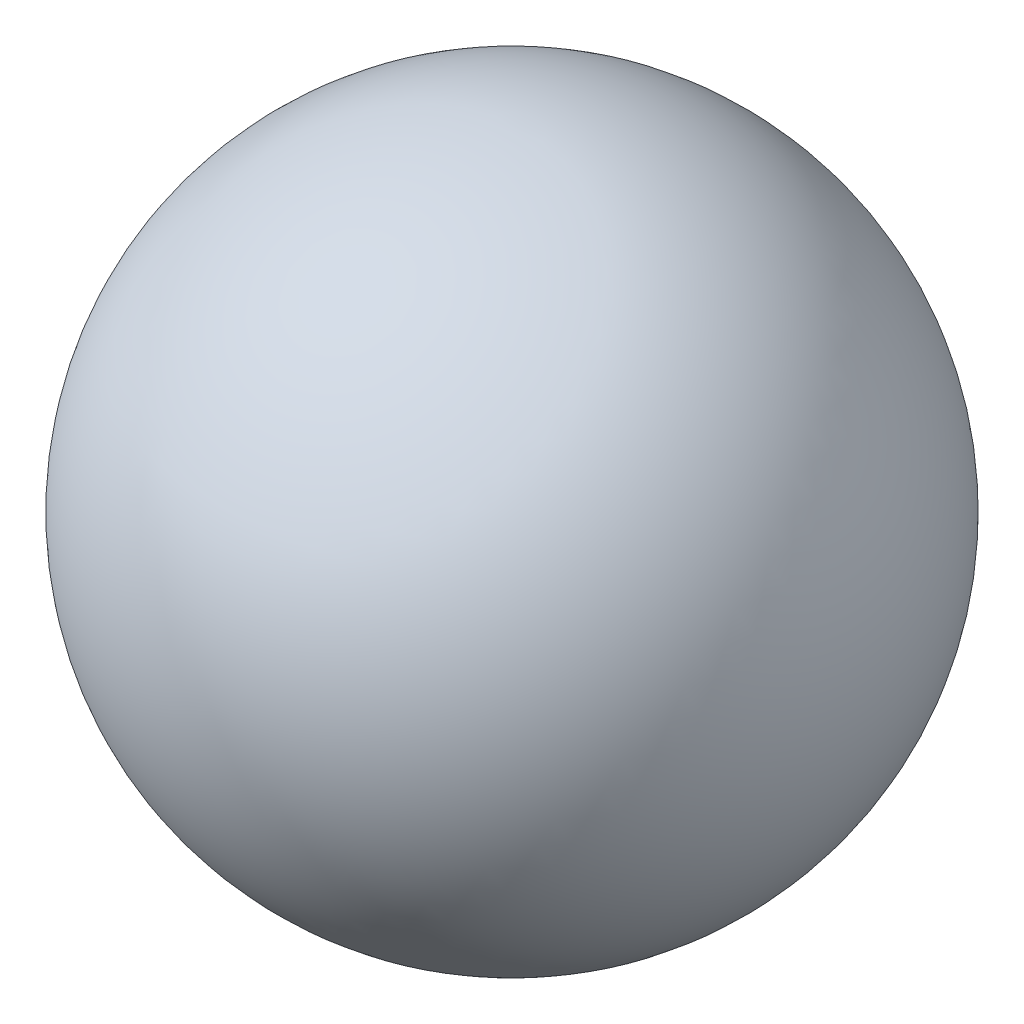
from build123d import *


with BuildPart() as part:
    # Sketch1 → Revolve1 (revolve)
    with BuildSketch(Plane.XY):
        with BuildLine():
            Line((0, -35), (0, 35))
            ThreePointArc((0, 35), (-35, 0), (0, -35))
        make_face()
    revolve(axis=Axis((0, -35, 0), (0, 1, 0)))


solid = part.part
